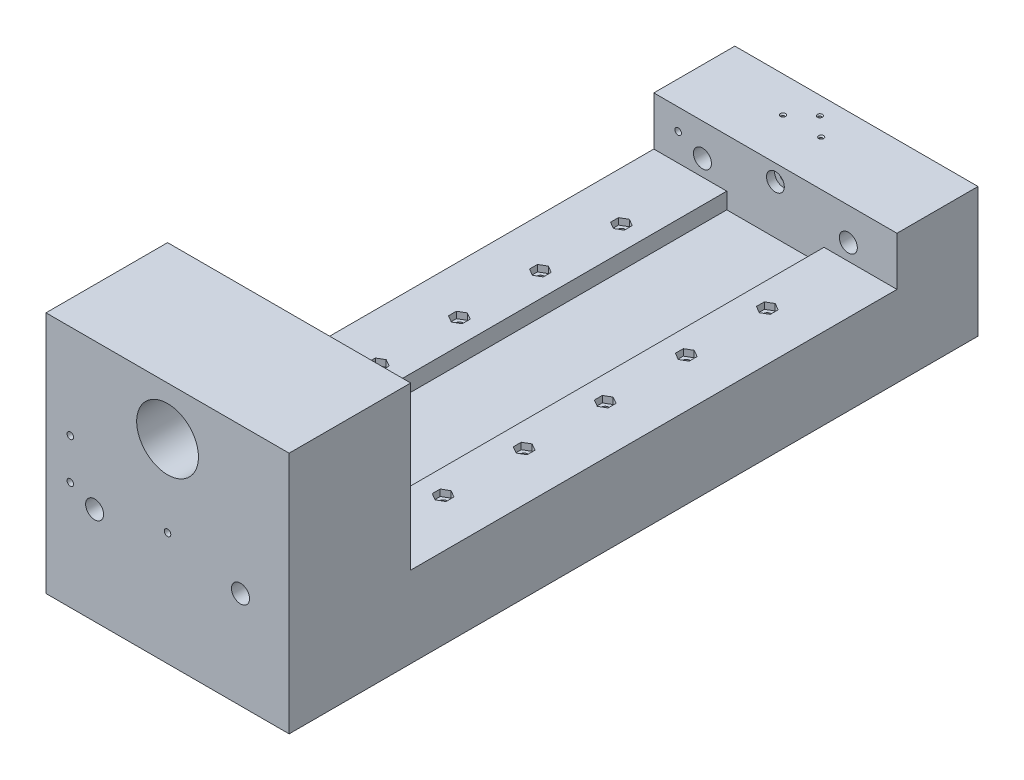
from build123d import *

# Parameters (mm, degrees)
RESSALTO_EXTRUS_O1_DEPTH                        = 150
CORTE_EXTRUS_O1_REACH                           = 915.783
ESBO_O2_R                                       = 38.1
ESBO_O2_R_2                                     = 4
ESBO_O2_R_3                                     = 11.11
SKETCH2_W                                       = 120
SKETCH2_H                                       = 600
CUT_EXTRUDE2_DEPTH                              = 20
CSK_FOR_M3_FLAT_HEAD_MACHINE_SCREW1_D           = 3.4
CSK_FOR_M3_FLAT_HEAD_MACHINE_SCREW1_DEPTH       = 10
CSK_FOR_M3_FLAT_HEAD_MACHINE_SCREW1_CSINK_D     = 6.3
CSK_FOR_M3_FLAT_HEAD_MACHINE_SCREW1_CSINK_ANGLE = 90
CSK_FOR_M3_FLAT_HEAD_MACHINE_SCREW1_TIP         = 1.021463052
SKETCH6_R                                       = 11
CUT_EXTRUDE3_DEPTH                              = 10
LPATTERN1_COUNT                                 = 2
LPATTERN1_PITCH                                 = 90
CUT_EXTRUDE4_START                              = 610
SKETCH6_2_R                                     = 11
CUT_EXTRUDE4_DEPTH                              = 10
TAP_DRILL_FOR_M10X1_0_TAP1_D                    = 9
TAP_DRILL_FOR_M10X1_0_TAP1_DEPTH                = 20
TAP_DRILL_FOR_M10X1_0_TAP1_TIP                  = 2.703872786
CUT_EXTRUDE5_DEPTH                              = 8


with BuildPart() as part:
    # Esboço1 → Ressalto-extrusão1 (new, symmetric)
    with BuildSketch(Plane(origin=(0, 0, 0), x_dir=(0, 0, -1), z_dir=(1, 0, 0))):
        Polygon((0, 0), (850, 0), (850, 160), (750, 160), (750, 100), (150, 100), (150, 300), (0, 300), align=None)
    extrude(amount=RESSALTO_EXTRUS_O1_DEPTH, both=True)

    # Corte-extrusão1: up to this face of the body (flat: up to its plane)
    corte_extrus_o1_end = Plane(part.part.faces().sort_by_distance((0, 80, -850))[0])
    # Esboço2 → Corte-extrusão1 (cut, up to the picked face)
    with BuildSketch(Plane.XY, mode=Mode.PRIVATE) as corte_extrus_o1_sk1:
        with Locations((0, 240)):
            Circle(ESBO_O2_R)
    corte_extrus_o1_tool1 = split(extrude(corte_extrus_o1_sk1.sketch, amount=-CORTE_EXTRUS_O1_REACH, mode=Mode.PRIVATE), bisect_by=corte_extrus_o1_end, keep=Keep.BOTH, mode=Mode.PRIVATE)
    # Esboço2 → Corte-extrusão1 (cut, up to the picked face)
    with BuildSketch(Plane.XY, mode=Mode.PRIVATE) as corte_extrus_o1_sk2:
        with Locations((0, 140)):
            Circle(ESBO_O2_R_2)
    corte_extrus_o1_tool2 = split(extrude(corte_extrus_o1_sk2.sketch, amount=-CORTE_EXTRUS_O1_REACH, mode=Mode.PRIVATE), bisect_by=corte_extrus_o1_end, keep=Keep.BOTH, mode=Mode.PRIVATE)
    # Esboço2 → Corte-extrusão1 (cut, up to the picked face)
    with BuildSketch(Plane.XY, mode=Mode.PRIVATE) as corte_extrus_o1_sk3:
        with Locations((-90, 120)):
            Circle(ESBO_O2_R_3)
    corte_extrus_o1_tool3 = split(extrude(corte_extrus_o1_sk3.sketch, amount=-CORTE_EXTRUS_O1_REACH, mode=Mode.PRIVATE), bisect_by=corte_extrus_o1_end, keep=Keep.BOTH, mode=Mode.PRIVATE)
    # Esboço2 → Corte-extrusão1 (cut, up to the picked face)
    with BuildSketch(Plane.XY, mode=Mode.PRIVATE) as corte_extrus_o1_sk4:
        with Locations((90, 120)):
            Circle(ESBO_O2_R_3)
    corte_extrus_o1_tool4 = split(extrude(corte_extrus_o1_sk4.sketch, amount=-CORTE_EXTRUS_O1_REACH, mode=Mode.PRIVATE), bisect_by=corte_extrus_o1_end, keep=Keep.BOTH, mode=Mode.PRIVATE)
    # Esboço2 → Corte-extrusão1 (cut, up to the picked face)
    with BuildSketch(Plane.XY, mode=Mode.PRIVATE) as corte_extrus_o1_sk5:
        with Locations((-120, 183.762072292)):
            Circle(ESBO_O2_R_2)
    corte_extrus_o1_tool5 = split(extrude(corte_extrus_o1_sk5.sketch, amount=-CORTE_EXTRUS_O1_REACH, mode=Mode.PRIVATE), bisect_by=corte_extrus_o1_end, keep=Keep.BOTH, mode=Mode.PRIVATE)
    # Esboço2 → Corte-extrusão1 (cut, up to the picked face)
    with BuildSketch(Plane.XY, mode=Mode.PRIVATE) as corte_extrus_o1_sk6:
        with Locations((-120, 133.762072292)):
            Circle(ESBO_O2_R_2)
    corte_extrus_o1_tool6 = split(extrude(corte_extrus_o1_sk6.sketch, amount=-CORTE_EXTRUS_O1_REACH, mode=Mode.PRIVATE), bisect_by=corte_extrus_o1_end, keep=Keep.BOTH, mode=Mode.PRIVATE)
    add(corte_extrus_o1_tool1.solids().sort_by(Axis((0, 240, 0), (0, 0, -1)))[0], mode=Mode.SUBTRACT)
    add(corte_extrus_o1_tool2.solids().sort_by(Axis((0, 140, 0), (0, 0, -1)))[0], mode=Mode.SUBTRACT)
    add(corte_extrus_o1_tool3.solids().sort_by(Axis((-90, 120, 0), (0, 0, -1)))[0], mode=Mode.SUBTRACT)
    add(corte_extrus_o1_tool4.solids().sort_by(Axis((90, 120, 0), (0, 0, -1)))[0], mode=Mode.SUBTRACT)
    add(corte_extrus_o1_tool5.solids().sort_by(Axis((-120, 183.762072, 0), (0, 0, -1)))[0], mode=Mode.SUBTRACT)
    add(corte_extrus_o1_tool6.solids().sort_by(Axis((-120, 133.762072, 0), (0, 0, -1)))[0], mode=Mode.SUBTRACT)

    # Sketch2 → Cut-Extrude2 (cut)
    with BuildSketch(Plane(origin=(0, 100, 0), x_dir=(1, 0, 0), z_dir=(0, 1, 0))):
        with Locations((0, 450)):
            Rectangle(SKETCH2_W, SKETCH2_H)
    extrude(amount=-CUT_EXTRUDE2_DEPTH, mode=Mode.SUBTRACT)

    # CSK for M3 Flat Head Machine Screw1
    with Locations(Plane(origin=(0, 160, 0), x_dir=(1, 0, 0), z_dir=(0, 1, 0))):
        with Locations((-46.6, 806), (-23.05, 828), (0.5, 806)):
            CounterSinkHole(CSK_FOR_M3_FLAT_HEAD_MACHINE_SCREW1_D / 2, CSK_FOR_M3_FLAT_HEAD_MACHINE_SCREW1_CSINK_D / 2, depth=CSK_FOR_M3_FLAT_HEAD_MACHINE_SCREW1_DEPTH, counter_sink_angle=CSK_FOR_M3_FLAT_HEAD_MACHINE_SCREW1_CSINK_ANGLE)
            with Locations((0, 0, -(CSK_FOR_M3_FLAT_HEAD_MACHINE_SCREW1_DEPTH + CSK_FOR_M3_FLAT_HEAD_MACHINE_SCREW1_TIP / 2))):  # 118° drill point
                Cone(0, CSK_FOR_M3_FLAT_HEAD_MACHINE_SCREW1_D / 2, CSK_FOR_M3_FLAT_HEAD_MACHINE_SCREW1_TIP, mode=Mode.SUBTRACT)

    # Sketch6 → Cut-Extrude3 (cut)
    with BuildSketch(Plane.XY.offset(-750)):
        with Locations((0, 140)):
            Circle(SKETCH6_R)
    cut_extrude3 = extrude(amount=-CUT_EXTRUDE3_DEPTH, mode=Mode.SUBTRACT)

    # LPattern1: Cut-Extrude3 ×2
    with Locations(*[(0, 0, -i * LPATTERN1_PITCH) for i in range(1, LPATTERN1_COUNT)]):
        add(cut_extrude3, mode=Mode.SUBTRACT)

    # Sketch6<2> → Cut-Extrude4 (cut)
    with BuildSketch(Plane.XY.offset(-750).offset(CUT_EXTRUDE4_START)):
        with Locations((0, 140)):
            Circle(SKETCH6_2_R)
    extrude(amount=-CUT_EXTRUDE4_DEPTH, mode=Mode.SUBTRACT)

    # Tap Drill for M10x1.0 Tap1
    with Locations(Plane(origin=(0, 100, 0), x_dir=(1, 0, 0), z_dir=(0, 1, 0))):
        with Locations((-90, 650), (90, 650), (-90, 550), (90, 550), (90, 450), (-90, 450), (-90, 350), (-90, 250), (90, 250), (90, 350)):
            Hole(TAP_DRILL_FOR_M10X1_0_TAP1_D / 2, depth=TAP_DRILL_FOR_M10X1_0_TAP1_DEPTH)
            with Locations((0, 0, -(TAP_DRILL_FOR_M10X1_0_TAP1_DEPTH + TAP_DRILL_FOR_M10X1_0_TAP1_TIP / 2))):  # 118° drill point
                Cone(0, TAP_DRILL_FOR_M10X1_0_TAP1_D / 2, TAP_DRILL_FOR_M10X1_0_TAP1_TIP, mode=Mode.SUBTRACT)

    # Sketch10 → Cut-Extrude5 (cut)
    with BuildSketch(Plane(origin=(0, 100, 0), x_dir=(1, 0, 0), z_dir=(0, 1, 0))):
        Polygon((-98.5, 645.092522712), (-90, 640.185045424), (-81.5, 645.092522712), (-81.5, 654.907477288), (-90, 659.814954576), (-98.5, 654.907477288), align=None)
        Polygon((98.5, 654.907477288), (98.5, 645.092522712), (90, 640.185045424), (81.5, 645.092522712), (81.5, 654.907477288), (90, 659.814954576), align=None)
        Polygon((-98.5, 545.092522712), (-90, 540.185045424), (-81.5, 545.092522712), (-81.5, 554.907477288), (-90, 559.814954576), (-98.5, 554.907477288), align=None)
        Polygon((98.5, 554.907477288), (98.5, 545.092522712), (90, 540.185045424), (81.5, 545.092522712), (81.5, 554.907477288), (90, 559.814954576), align=None)
        Polygon((-98.5, 445.092522712), (-90, 440.185045424), (-81.5, 445.092522712), (-81.5, 454.907477288), (-90, 459.814954576), (-98.5, 454.907477288), align=None)
        Polygon((98.5, 454.907477288), (98.5, 445.092522712), (90, 440.185045424), (81.5, 445.092522712), (81.5, 454.907477288), (90, 459.814954576), align=None)
        Polygon((-98.5, 345.092522712), (-90, 340.185045424), (-81.5, 345.092522712), (-81.5, 354.907477288), (-90, 359.814954576), (-98.5, 354.907477288), align=None)
        Polygon((98.5, 354.907477288), (98.5, 345.092522712), (90, 340.185045424), (81.5, 345.092522712), (81.5, 354.907477288), (90, 359.814954576), align=None)
        Polygon((-98.5, 245.092522712), (-90, 240.185045424), (-81.5, 245.092522712), (-81.5, 254.907477288), (-90, 259.814954576), (-98.5, 254.907477288), align=None)
        Polygon((98.5, 254.907477288), (98.5, 245.092522712), (90, 240.185045424), (81.5, 245.092522712), (81.5, 254.907477288), (90, 259.814954576), align=None)
    extrude(amount=-CUT_EXTRUDE5_DEPTH, mode=Mode.SUBTRACT)


solid = part.part
